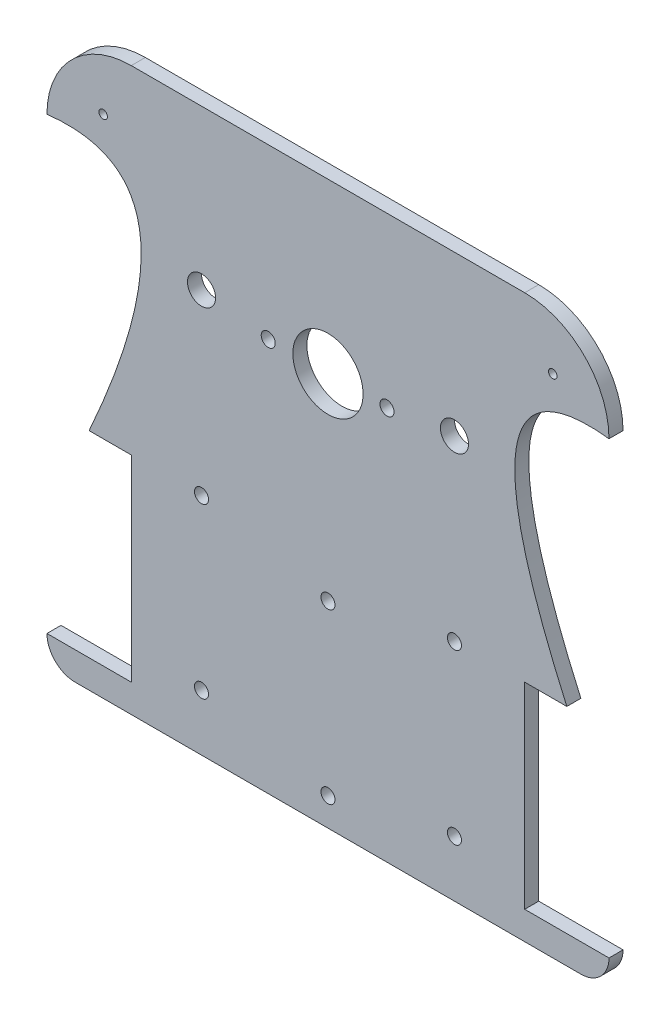
from build123d import *

# Parameters (mm, degrees)
BOSS_EXTRUDE1_DEPTH = 5
SKETCH2_W           = 30
SKETCH2_H           = 70
CUT_EXTRUDE1_DEPTH  = 5
CUT_EXTRUDE2_DEPTH  = 5
SKETCH5_R           = 2.5
SKETCH5_R_2         = 5
CUT_EXTRUDE3_DEPTH  = 5
SKETCH6_R           = 2.5
CUT_EXTRUDE4_DEPTH  = 5
SKETCH7_R           = 12.5
SKETCH7_R_2         = 2.5
CUT_EXTRUDE5_DEPTH  = 5
SKETCH8_R           = 1.5
CUT_EXTRUDE6_DEPTH  = 5


with BuildPart() as part:
    # Sketch1 → Boss-Extrude1 (new body)
    with BuildSketch(Plane.XY):
        with BuildLine():
            Line((-90, -100), (90, -100))
            ThreePointArc((90, -100), (97.071067812, -97.071067812), (100, -90))
            Line((100, -90), (100, 70))
            ThreePointArc((100, 70), (91.213203436, 91.213203436), (70, 100))
            Line((70, 100), (-70, 100))
            ThreePointArc((-70, 100), (-91.213203436, 91.213203436), (-100, 70))
            Line((-100, 70), (-100, -90))
            ThreePointArc((-100, -90), (-97.071067812, -97.071067812), (-90, -100))
        make_face()
    extrude(amount=BOSS_EXTRUDE1_DEPTH)

    # Sketch2 → Cut-Extrude1 (cut)
    with BuildSketch(Plane.XY.offset(5)):
        with Locations((85, -55)):
            Rectangle(SKETCH2_W, SKETCH2_H)
        with Locations((-85, -55)):
            Rectangle(SKETCH2_W, SKETCH2_H)
    extrude(amount=-CUT_EXTRUDE1_DEPTH, mode=Mode.SUBTRACT)

    # Sketch3 → Cut-Extrude2 (cut)
    with BuildSketch(Plane.XY.offset(5)):
        with BuildLine():
            Line((85, -20), (100, -20))
            Line((100, -20), (100, 70))
            add(Edge.make_bspline(
                [(100, 70), (41.562750789, 76.769648156), (85, -20)],
                knots=[0, 0, 0, 1, 1, 1], degree=2))
        make_face()
        with BuildLine():
            Line((-85, -20), (-100, -20))
            Line((-100, -20), (-100, 70))
            add(Edge.make_bspline(
                [(-100, 70), (-41.562750789, 76.769648156), (-85, -20)],
                knots=[0, 0, 0, 1, 1, 1], degree=2))
        make_face()
    extrude(amount=-CUT_EXTRUDE2_DEPTH, mode=Mode.SUBTRACT)

    # Sketch5 → Cut-Extrude3 (cut)
    with BuildSketch(Plane.XY.offset(5)):
        with Locations((45, -80)):
            Circle(SKETCH5_R)
        with Locations((-45, -80)):
            Circle(SKETCH5_R)
        with Locations(Location((45, -20, 0), (0, 0, 180))):
            Circle(SKETCH5_R)
        with Locations(Location((-45, -20, 0), (0, 0, 180))):
            Circle(SKETCH5_R)
        with Locations((-45, 43.350998567)):
            Circle(SKETCH5_R_2)
        with Locations(Location((45, 43.350998567, 0), (0, 0, 180))):
            Circle(SKETCH5_R_2)
        with Locations((0, -30)):
            Circle(SKETCH5_R)
    extrude(amount=-CUT_EXTRUDE3_DEPTH, mode=Mode.SUBTRACT)

    # Sketch6 → Cut-Extrude4 (cut)
    with BuildSketch(Plane.XY.offset(5)):
        with Locations((0, -90)):
            Circle(SKETCH6_R)
    extrude(amount=-CUT_EXTRUDE4_DEPTH, mode=Mode.SUBTRACT)

    # Sketch7 → Cut-Extrude5 (cut)
    with BuildSketch(Plane(origin=(0, 0, 0), x_dir=(-1, 0, 0), z_dir=(0, 0, -1))):
        with Locations((0, 40)):
            Circle(SKETCH7_R)
        with Locations((-21, 40)):
            Circle(SKETCH7_R_2)
        with Locations((21.26, 40)):
            Circle(SKETCH7_R_2)
    extrude(amount=-CUT_EXTRUDE5_DEPTH, mode=Mode.SUBTRACT)

    # Sketch8 → Cut-Extrude6 (cut)
    with BuildSketch(Plane.XY.offset(5)):
        with Locations((-80, 80)):
            Circle(SKETCH8_R)
        with Locations((80, 80)):
            Circle(SKETCH8_R)
    extrude(amount=-CUT_EXTRUDE6_DEPTH, mode=Mode.SUBTRACT)


solid = part.part
